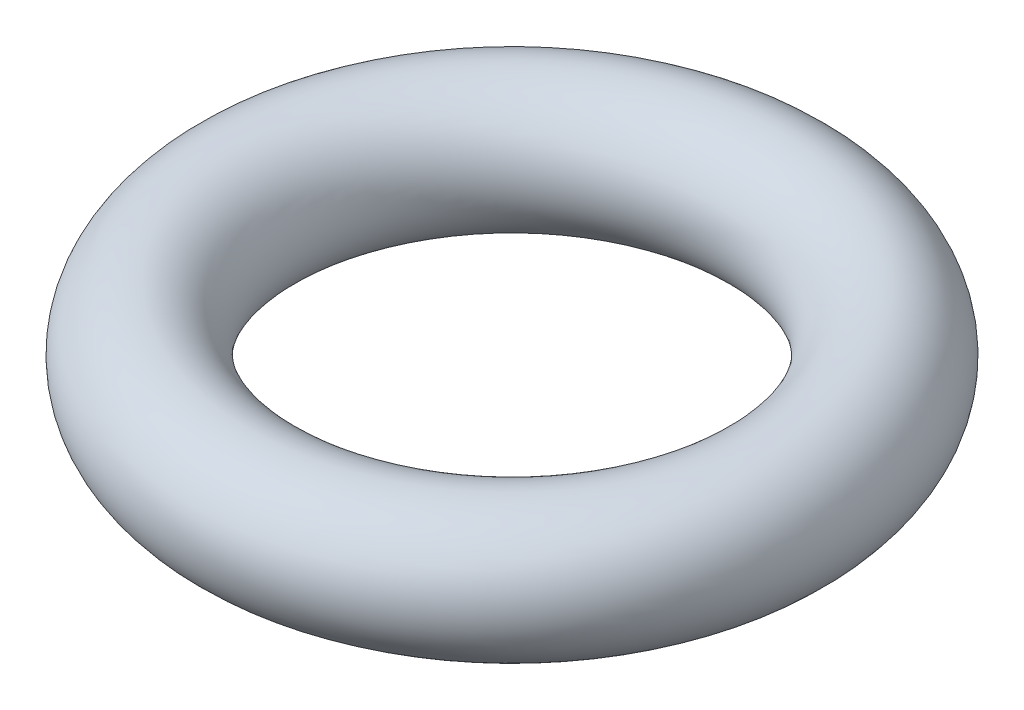
from build123d import *

# Parameters (mm, degrees)
SKETCH1_R = 5


with BuildPart() as part:
    # Sketch1 → Revolve1 (revolve)
    with BuildSketch(Plane.XY, mode=Mode.PRIVATE) as revolve1_sk:
        with Locations((-20, 0)):
            Circle(SKETCH1_R)
    revolve(revolve1_sk.sketch.rotate(Axis((0, 0, 0), (0, 1, 0)), 270), axis=Axis((0, 0, 0), (0, 1, 0)))


solid = part.part
